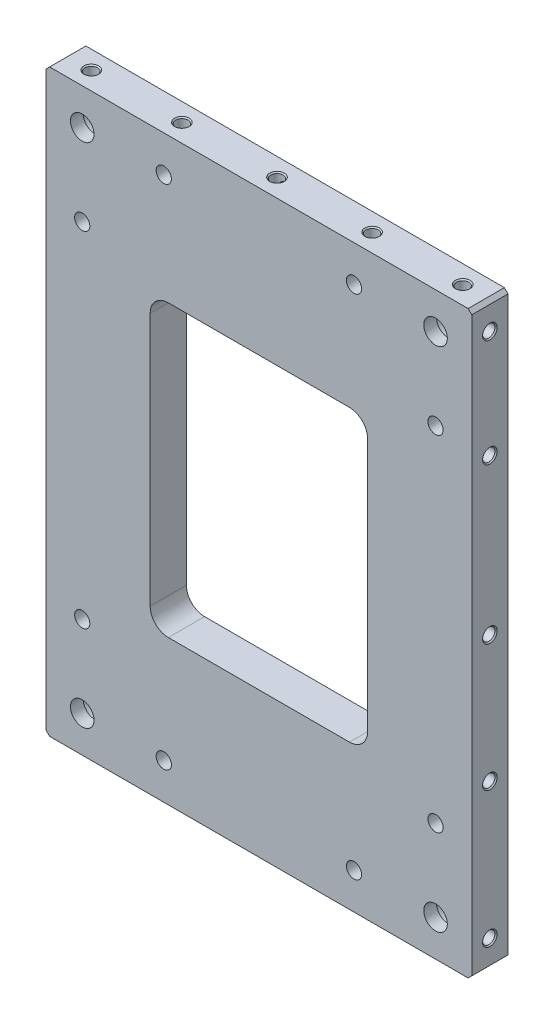
from build123d import *

# Parameters (mm, degrees)
SKETCH1_W                                            = 235
SKETCH1_H                                            = 320
BOSS_EXTRUDE1_DEPTH                                  = 20
SKETCH2_W                                            = 120
SKETCH2_H                                            = 160
CUT_EXTRUDE1_DEPTH                                   = 200.515037027
FILLET1_R                                            = 10
M3_TAPPED_HOLE1_D                                    = 2.5
M3_TAPPED_HOLE1_DEPTH                                = 10
M3_TAPPED_HOLE1_CSINK_D                              = 3.05
M3_TAPPED_HOLE1_CSINK_ANGLE                          = 90
M3_TAPPED_HOLE1_TIP                                  = 0.751075774
M3_TAPPED_HOLE2_D                                    = 2.5
M3_TAPPED_HOLE2_DEPTH                                = 8
M3_TAPPED_HOLE2_CSINK_D                              = 3.05
M3_TAPPED_HOLE2_CSINK_ANGLE                          = 90
M3_TAPPED_HOLE2_TIP                                  = 0.751075774
CBORE_FOR_M8_HEXAGON_SOCKET_HEAD_CAP_SCR_D           = 8.4
CBORE_FOR_M8_HEXAGON_SOCKET_HEAD_CAP_SCR_CBORE_D     = 15
CBORE_FOR_M8_HEXAGON_SOCKET_HEAD_CAP_SCR_CBORE_DEPTH = 9
CBORE_FOR_M12_HEXAGON_SOCKET_HEAD_CAP_SC_D           = 13
CBORE_FOR_M12_HEXAGON_SOCKET_HEAD_CAP_SC_CBORE_D     = 20
CBORE_FOR_M12_HEXAGON_SOCKET_HEAD_CAP_SC_CBORE_DEPTH = 13
M8_TAPPED_HOLE1_AT_2_COUNT                           = 2
M8_TAPPED_HOLE1_AT_2_PITCH                           = 102.5
M8_TAPPED_HOLE1_AT_3_COUNT                           = 2
M8_TAPPED_HOLE1_AT_3_PITCH                           = 205
M8_TAPPED_HOLE1_AT_4_COUNT                           = 2
M8_TAPPED_HOLE1_AT_4_PITCH                           = 50
M8_TAPPED_HOLE1_AT_5_COUNT                           = 2
M8_TAPPED_HOLE1_AT_5_PITCH                           = 155
CHAMFER1_SIZE                                        = 2
M8_TAPPED_HOLE2_AT_2_COUNT                           = 2
M8_TAPPED_HOLE2_AT_2_PITCH                           = 59.289517351
M8_TAPPED_HOLE2_AT_3_COUNT                           = 2
M8_TAPPED_HOLE2_AT_3_PITCH                           = 145
M8_TAPPED_HOLE2_AT_4_COUNT                           = 2
M8_TAPPED_HOLE2_AT_4_PITCH                           = 215
M8_TAPPED_HOLE2_AT_5_COUNT                           = 2
M8_TAPPED_HOLE2_AT_5_PITCH                           = 290


with BuildPart() as part:
    # Sketch1 → Boss-Extrude1 (new body)
    with BuildSketch(Plane.XY):
        Rectangle(SKETCH1_W, SKETCH1_H)
    extrude(amount=BOSS_EXTRUDE1_DEPTH)

    # Sketch2 → Cut-Extrude1 (cut, through all)
    with BuildSketch(Plane.XY.offset(20)):
        Rectangle(SKETCH2_W, SKETCH2_H)
    extrude(amount=-CUT_EXTRUDE1_DEPTH, mode=Mode.SUBTRACT)

    # Fillet1
    fillet1_edges = [part.edges().sort_by_distance(p)[0] for p in [
        (60, 80, 10),
        (60, -80, 10),
        (-60, -80, 10),
        (-60, 80, 10),
    ]]
    fillet(fillet1_edges, radius=FILLET1_R)

    # M3 Tapped Hole1
    with Locations(Plane(origin=(0, 0, 0), x_dir=(-1, 0, 0), z_dir=(0, 0, -1))):
        with Locations((-95, 65), (-105, 0), (-95, -65), (-65, 145), (0, 155), (65, 145)):
            CounterSinkHole(M3_TAPPED_HOLE1_D / 2, M3_TAPPED_HOLE1_CSINK_D / 2, depth=M3_TAPPED_HOLE1_DEPTH, counter_sink_angle=M3_TAPPED_HOLE1_CSINK_ANGLE)
            with Locations((0, 0, -(M3_TAPPED_HOLE1_DEPTH + M3_TAPPED_HOLE1_TIP / 2))):  # 118° drill point
                Cone(0, M3_TAPPED_HOLE1_D / 2, M3_TAPPED_HOLE1_TIP, mode=Mode.SUBTRACT)

    # M3 Tapped Hole2
    with Locations(Plane(origin=(0, 0, 0), x_dir=(-1, 0, 0), z_dir=(0, 0, -1))):
        with Locations((110, -105), (80, -140), (65, -140), (110, -120)):
            CounterSinkHole(M3_TAPPED_HOLE2_D / 2, M3_TAPPED_HOLE2_CSINK_D / 2, depth=M3_TAPPED_HOLE2_DEPTH, counter_sink_angle=M3_TAPPED_HOLE2_CSINK_ANGLE)
            with Locations((0, 0, -(M3_TAPPED_HOLE2_DEPTH + M3_TAPPED_HOLE2_TIP / 2))):  # 118° drill point
                Cone(0, M3_TAPPED_HOLE2_D / 2, M3_TAPPED_HOLE2_TIP, mode=Mode.SUBTRACT)

    # CBORE for M8 Hexagon socket head cap screws1 (through all)
    with Locations(Plane(origin=(0, 0, 0), x_dir=(-1, 0, 0), z_dir=(0, 0, -1))):
        with Locations((-52.5, 140), (-97.5, 95), (52.5, 140), (97.5, 95), (-97.5, -95), (-52.5, -140), (52.5, -140), (97.5, -95)):
            CounterBoreHole(CBORE_FOR_M8_HEXAGON_SOCKET_HEAD_CAP_SCR_D / 2, CBORE_FOR_M8_HEXAGON_SOCKET_HEAD_CAP_SCR_CBORE_D / 2, CBORE_FOR_M8_HEXAGON_SOCKET_HEAD_CAP_SCR_CBORE_DEPTH)

    # CBORE for M12 Hexagon socket head cap screws2 (through all)
    with Locations(Plane(origin=(0, 0, 0), x_dir=(-1, 0, 0), z_dir=(0, 0, -1))):
        with Locations((-97.5, 140), (97.5, 140), (-97.5, -140), (97.5, -140)):
            CounterBoreHole(CBORE_FOR_M12_HEXAGON_SOCKET_HEAD_CAP_SC_D / 2, CBORE_FOR_M12_HEXAGON_SOCKET_HEAD_CAP_SC_CBORE_D / 2, CBORE_FOR_M12_HEXAGON_SOCKET_HEAD_CAP_SC_CBORE_DEPTH)

    # Sketch24 → M8 Tapped Hole1 (revolve, cut)
    with BuildSketch(Plane(origin=(-102.5, 160, 10), x_dir=(0, 0, 1), z_dir=(1, 0, 0))):
        Polygon((0, 0), (0, 10.542926105), (3.4, 8.5), (3.4, 0.625), (4.025, 0), align=None)
    m8_tapped_hole1 = revolve(axis=Axis((-102.5, 166.35, 10), (0, -1, 0)), mode=Mode.SUBTRACT)

    # M8 Tapped Hole1 at 2: M8 Tapped Hole1 ×2
    with Locations(*[(i * M8_TAPPED_HOLE1_AT_2_PITCH, 0, 0) for i in range(1, M8_TAPPED_HOLE1_AT_2_COUNT)]):
        add(m8_tapped_hole1, mode=Mode.SUBTRACT)

    # M8 Tapped Hole1 at 3: M8 Tapped Hole1 ×2
    with Locations(*[(i * M8_TAPPED_HOLE1_AT_3_PITCH, 0, 0) for i in range(1, M8_TAPPED_HOLE1_AT_3_COUNT)]):
        add(m8_tapped_hole1, mode=Mode.SUBTRACT)

    # M8 Tapped Hole1 at 4: M8 Tapped Hole1 ×2
    with Locations(*[(i * M8_TAPPED_HOLE1_AT_4_PITCH, 0, 0) for i in range(1, M8_TAPPED_HOLE1_AT_4_COUNT)]):
        add(m8_tapped_hole1, mode=Mode.SUBTRACT)

    # M8 Tapped Hole1 at 5: M8 Tapped Hole1 ×2
    with Locations(*[(i * M8_TAPPED_HOLE1_AT_5_PITCH, 0, 0) for i in range(1, M8_TAPPED_HOLE1_AT_5_COUNT)]):
        add(m8_tapped_hole1, mode=Mode.SUBTRACT)

    # Mirror1: M8 Tapped Hole1 across plane
    add(m8_tapped_hole1.mirror(Plane.ZX), mode=Mode.SUBTRACT)

    # Mirror1 copy 1 sketch → Mirror1 copy 1 (revolve, cut)
    with BuildSketch(Plane(origin=(0, -160, 10), x_dir=(0, 0, 1), z_dir=(1, 0, 0))):
        Polygon((0, 0), (0, -10.542926105), (3.4, -8.5), (3.4, -0.625), (4.025, 0), align=None)
    revolve(axis=Axis((0, -166.35, 10), (0, -1, 0)), mode=Mode.SUBTRACT)

    # Mirror1 copy 2 sketch → Mirror1 copy 2 (revolve, cut)
    with BuildSketch(Plane(origin=(102.5, -160, 10), x_dir=(0, 0, 1), z_dir=(1, 0, 0))):
        Polygon((0, 0), (0, -10.542926105), (3.4, -8.5), (3.4, -0.625), (4.025, 0), align=None)
    revolve(axis=Axis((102.5, -166.35, 10), (0, -1, 0)), mode=Mode.SUBTRACT)

    # Mirror1 copy 3 sketch → Mirror1 copy 3 (revolve, cut)
    with BuildSketch(Plane(origin=(-52.5, -160, 10), x_dir=(0, 0, 1), z_dir=(1, 0, 0))):
        Polygon((0, 0), (0, -10.542926105), (3.4, -8.5), (3.4, -0.625), (4.025, 0), align=None)
    revolve(axis=Axis((-52.5, -166.35, 10), (0, -1, 0)), mode=Mode.SUBTRACT)

    # Mirror1 copy 4 sketch → Mirror1 copy 4 (revolve, cut)
    with BuildSketch(Plane(origin=(52.5, -160, 10), x_dir=(0, 0, 1), z_dir=(1, 0, 0))):
        Polygon((0, 0), (0, -10.542926105), (3.4, -8.5), (3.4, -0.625), (4.025, 0), align=None)
    revolve(axis=Axis((52.5, -166.35, 10), (0, -1, 0)), mode=Mode.SUBTRACT)

    # Chamfer1
    chamfer1_edges = [part.edges().sort_by_distance(p)[0] for p in [
        (117.5, -160, 10),
        (-117.5, -160, 10),
        (-117.5, 160, 10),
        (117.5, 160, 10),
    ]]
    chamfer(chamfer1_edges, length=CHAMFER1_SIZE)

    # Sketch27 → M8 Tapped Hole2 (revolve, cut)
    with BuildSketch(Plane(origin=(-117.5, 145, 10), x_dir=(0, 0, 1), z_dir=(0, 1, 0))):
        Polygon((0, 0), (0, 10.042926105), (3.4, 8), (3.4, 0.625), (4.025, 0), align=None)
    m8_tapped_hole2 = revolve(axis=Axis((-123.85, 145, 10), (1, 0, 0)), mode=Mode.SUBTRACT)

    # M8 Tapped Hole2 at 2: M8 Tapped Hole2 ×2
    with Locations(*[(0, -i * M8_TAPPED_HOLE2_AT_2_PITCH, 0) for i in range(1, M8_TAPPED_HOLE2_AT_2_COUNT)]):
        add(m8_tapped_hole2, mode=Mode.SUBTRACT)

    # M8 Tapped Hole2 at 3: M8 Tapped Hole2 ×2
    with Locations(*[(0, -i * M8_TAPPED_HOLE2_AT_3_PITCH, 0) for i in range(1, M8_TAPPED_HOLE2_AT_3_COUNT)]):
        add(m8_tapped_hole2, mode=Mode.SUBTRACT)

    # M8 Tapped Hole2 at 4: M8 Tapped Hole2 ×2
    with Locations(*[(0, -i * M8_TAPPED_HOLE2_AT_4_PITCH, 0) for i in range(1, M8_TAPPED_HOLE2_AT_4_COUNT)]):
        add(m8_tapped_hole2, mode=Mode.SUBTRACT)

    # M8 Tapped Hole2 at 5: M8 Tapped Hole2 ×2
    with Locations(*[(0, -i * M8_TAPPED_HOLE2_AT_5_PITCH, 0) for i in range(1, M8_TAPPED_HOLE2_AT_5_COUNT)]):
        add(m8_tapped_hole2, mode=Mode.SUBTRACT)

    # Mirror2: M8 Tapped Hole2 across plane
    add(m8_tapped_hole2.mirror(Plane(origin=(0, 0, 0), x_dir=(0, 0, 1), z_dir=(1, 0, 0))), mode=Mode.SUBTRACT)

    # Mirror2 copy 1 sketch → Mirror2 copy 1 (revolve, cut)
    with BuildSketch(Plane(origin=(117.5, 85.710482649, 10), x_dir=(0, 0, 1), z_dir=(0, 1, 0))):
        Polygon((0, 0), (0, -10.042926105), (3.4, -8), (3.4, -0.625), (4.025, 0), align=None)
    revolve(axis=Axis((123.85, 85.710482649, 10), (1, 0, 0)), mode=Mode.SUBTRACT)

    # Mirror2 copy 2 sketch → Mirror2 copy 2 (revolve, cut)
    with BuildSketch(Plane(origin=(117.5, 0, 10), x_dir=(0, 0, 1), z_dir=(0, 1, 0))):
        Polygon((0, 0), (0, -10.042926105), (3.4, -8), (3.4, -0.625), (4.025, 0), align=None)
    revolve(axis=Axis((123.85, 0, 10), (1, 0, 0)), mode=Mode.SUBTRACT)

    # Mirror2 copy 3 sketch → Mirror2 copy 3 (revolve, cut)
    with BuildSketch(Plane(origin=(117.5, -70, 10), x_dir=(0, 0, 1), z_dir=(0, 1, 0))):
        Polygon((0, 0), (0, -10.042926105), (3.4, -8), (3.4, -0.625), (4.025, 0), align=None)
    revolve(axis=Axis((123.85, -70, 10), (1, 0, 0)), mode=Mode.SUBTRACT)

    # Mirror2 copy 4 sketch → Mirror2 copy 4 (revolve, cut)
    with BuildSketch(Plane(origin=(117.5, -145, 10), x_dir=(0, 0, 1), z_dir=(0, 1, 0))):
        Polygon((0, 0), (0, -10.042926105), (3.4, -8), (3.4, -0.625), (4.025, 0), align=None)
    revolve(axis=Axis((123.85, -145, 10), (1, 0, 0)), mode=Mode.SUBTRACT)


solid = part.part
